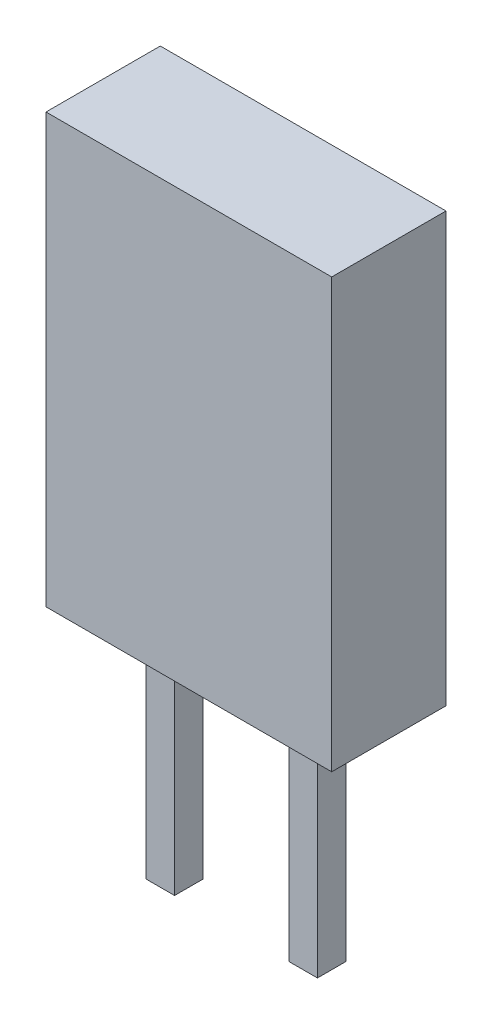
from build123d import *

# Parameters (mm, degrees)
SKETCH_1_W        = 5
SKETCH_1_H        = 7.5
EXTRUDE_1_DEPTH   = 1
EXTRUDE_2_DEPTH   = 0.25
EXTRUDE_2_2_DEPTH = 0.25
FILLET_1_R        = 0.2
FILLET_2_R        = 0.2


with BuildPart() as part:
    # 草图1 → 凸台-拉伸1 (new, symmetric)
    with BuildSketch(Plane.XY):
        Rectangle(SKETCH_1_W, SKETCH_1_H)
    extrude(amount=EXTRUDE_1_DEPTH, both=True)


with BuildPart() as body_2:
    # 草图3 → 凸台-拉伸2 (new, symmetric)
    with BuildSketch(Plane.XY):
        Polygon((1.5, -3.75), (1.5, -1.95), (1.3, -1.75), (1.3, 0.25), (-1.2, 0.25), (0.5, -1.95), (1, -1.95), (1, -3.75), (1, -7.75), (1.5, -7.75), align=None)
    extrude(amount=EXTRUDE_2_DEPTH, both=True)

    # 圆角1
    fillet_1_edges = [body_2.edges().sort_by_distance(p)[0] for p in [
        (1, -1.95, 0),
        (0.5, -1.95, 0),
        (1.3, -1.75, 0),
        (1.5, -1.95, 0),
    ]]
    fillet(fillet_1_edges, radius=FILLET_1_R)


with BuildPart() as body_3:
    # 草图3 → Extrude 2 2 (new, symmetric)
    with BuildSketch(Plane.XY):
        Polygon((-1.5, -3.75), (-1.5, -7.75), (-1, -7.75), (-1, -3.75), (-1, -1.95), (-0.2, -1.75), (-1.3, 0.25), (-1.3, -1.75), (-1.5, -1.95), align=None)
    extrude(amount=EXTRUDE_2_2_DEPTH, both=True)

    # 圆角2
    fillet_2_edges = [body_3.edges().sort_by_distance(p)[0] for p in [
        (-1, -1.95, 0),
        (-1.5, -1.95, 0),
        (-1.3, -1.75, 0),
    ]]
    fillet(fillet_2_edges, radius=FILLET_2_R)


solid = Compound([part.part, body_2.part, body_3.part])
